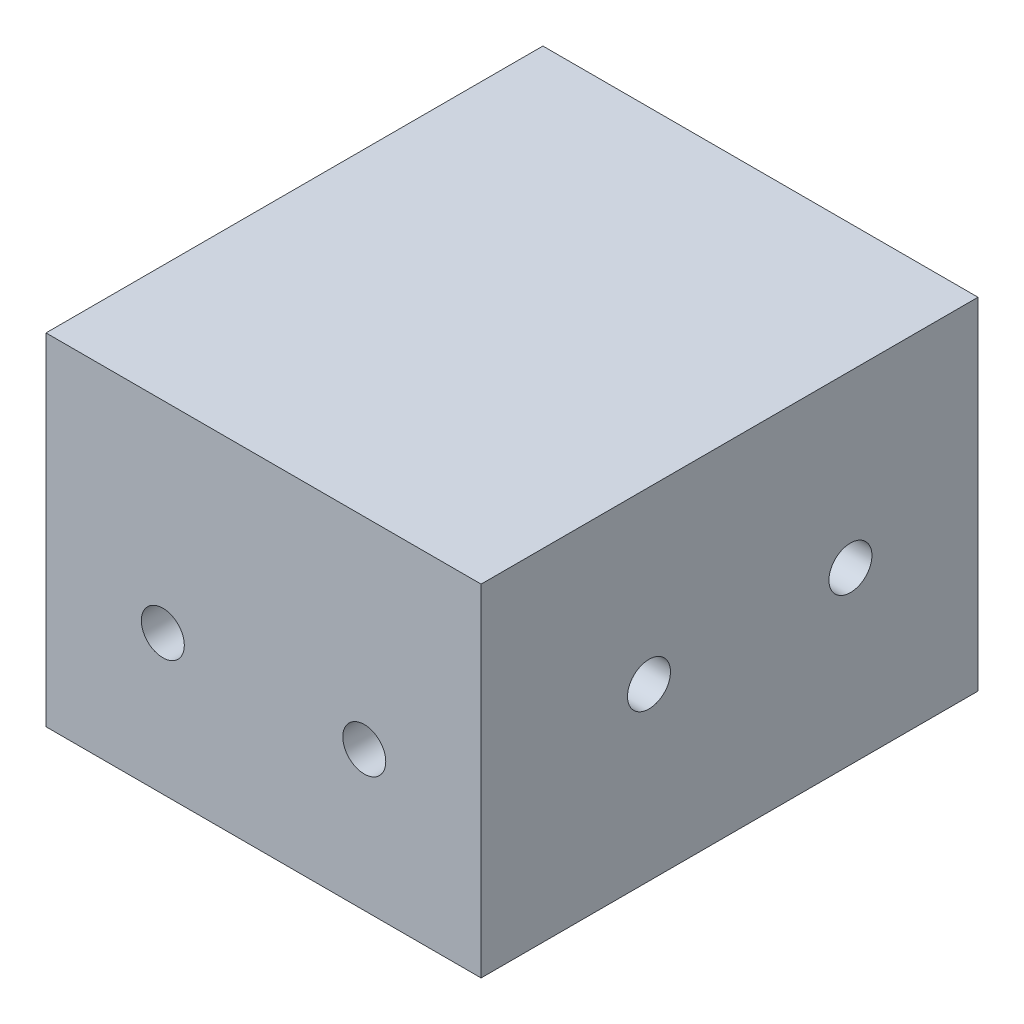
from build123d import *

# Parameters (mm, degrees)
SKETCH1_W           = 32.4
SKETCH1_H           = 25.4
BOSS_EXTRUDE1_DEPTH = 35
SHELL1_T            = -4
SKETCH2_R           = 1.6
CUT_EXTRUDE1_DEPTH  = 55.036284106
CUT_EXTRUDE2_REACH  = 56.036
SKETCH3_R           = 1.6
CUT_EXTRUDE3_DEPTH  = 2
BOSS_EXTRUDE2_START = 2
SKETCH7_W           = 32.4
SKETCH7_H           = 25.4
SKETCH7_R           = 1.6
BOSS_EXTRUDE2_DEPTH = 2


with BuildPart() as part:
    # Sketch1 → Boss-Extrude1 (new body)
    with BuildSketch(Plane.XY):
        with Locations((16.2, 12.7)):
            Rectangle(SKETCH1_W, SKETCH1_H)
    extrude(amount=BOSS_EXTRUDE1_DEPTH)

    # Shell1
    shell1_openings = [part.faces().sort_by_distance(p)[0] for p in [
        (16.2, 0, 17.5),
    ]]
    offset(amount=SHELL1_T, openings=shell1_openings, kind=Kind.INTERSECTION)

    # Sketch2 → Cut-Extrude1 (cut, through all)
    with BuildSketch(Plane(origin=(32.4, 0, 0), x_dir=(0, 0, -1), z_dir=(1, 0, 0))):
        with Locations((-24.5, 12.7)):
            Circle(SKETCH2_R)
        with Locations((-9.5, 12.7)):
            Circle(SKETCH2_R)
    extrude(amount=-CUT_EXTRUDE1_DEPTH, mode=Mode.SUBTRACT)

    # Sketch3 → Cut-Extrude2 (cut, up to next)
    with BuildSketch(Plane.XY.offset(35), mode=Mode.PRIVATE) as cut_extrude2_sk1:
        with Locations((8.7, 10.4)):
            Circle(SKETCH3_R)
    cut_extrude2_tool1 = extrude(cut_extrude2_sk1.sketch, amount=-CUT_EXTRUDE2_REACH, mode=Mode.PRIVATE) & part.part
    # Sketch3 → Cut-Extrude2 (cut, up to next)
    with BuildSketch(Plane.XY.offset(35), mode=Mode.PRIVATE) as cut_extrude2_sk2:
        with Locations((23.7, 10.4)):
            Circle(SKETCH3_R)
    cut_extrude2_tool2 = extrude(cut_extrude2_sk2.sketch, amount=-CUT_EXTRUDE2_REACH, mode=Mode.PRIVATE) & part.part
    add(cut_extrude2_tool1.solids().sort_by_distance((8.7, 10.4, 35))[0], mode=Mode.SUBTRACT)
    add(cut_extrude2_tool2.solids().sort_by_distance((23.7, 10.4, 35))[0], mode=Mode.SUBTRACT)

    # Sketch4 → Cut-Extrude3 (cut)
    with BuildSketch(Plane(origin=(0, 0, 31), x_dir=(-1, 0, 0), z_dir=(0, 0, -1))):
        Polygon((-10.28771324, 13.15), (-11.875426481, 10.4), (-10.28771324, 7.65), (-7.11228676, 7.65), (-5.524573519, 10.4), (-7.11228676, 13.15), align=None)
        Polygon((-25.28771324, 13.15), (-26.875426481, 10.4), (-25.28771324, 7.65), (-22.11228676, 7.65), (-20.524573519, 10.4), (-22.11228676, 13.15), align=None)
    extrude(amount=-CUT_EXTRUDE3_DEPTH, mode=Mode.SUBTRACT)

    # Sketch7 → Boss-Extrude2 (add)
    with BuildSketch(Plane.XY.offset(35).offset(BOSS_EXTRUDE2_START)):
        with Locations((16.2, 12.7)):
            Rectangle(SKETCH7_W, SKETCH7_H)
        with Locations((8.7, 10.4)):
            Circle(SKETCH7_R, mode=Mode.SUBTRACT)
        with Locations((23.7, 10.4)):
            Circle(SKETCH7_R, mode=Mode.SUBTRACT)
    extrude(amount=-BOSS_EXTRUDE2_DEPTH)


solid = part.part
